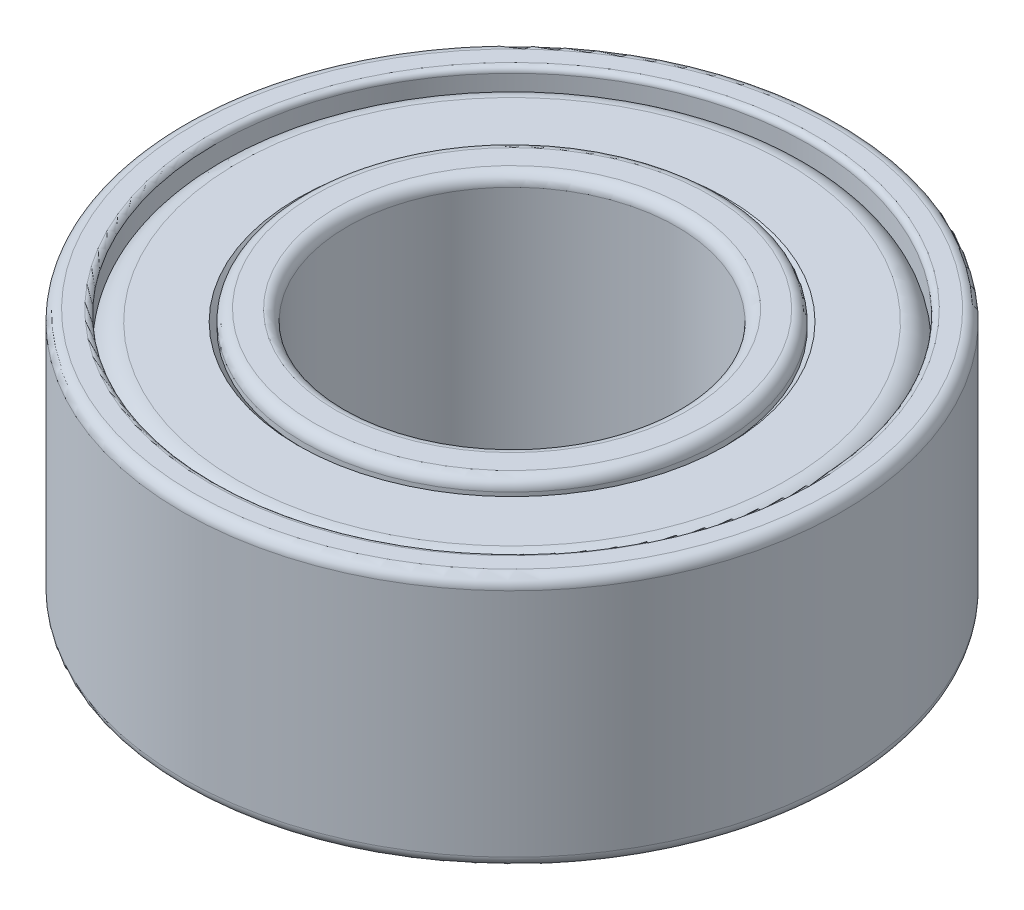
from build123d import *

# Parameters (mm, degrees)
SKETCH2_R           = 1.9
SKETCH2_R_2         = 1.5
BOSS_EXTRUDE1_DEPTH = 1.15
SKETCH4_R           = 3
SKETCH4_R_2         = 2.7
BOSS_EXTRUDE2_DEPTH = 1.15
FILLET1_R           = 0.1
FILLET2_R           = 0.1
FILLET3_R           = 0.05
SKETCH5_R           = 2.7
SKETCH5_R_2         = 1.9
BOSS_EXTRUDE3_DEPTH = 1.05
FILLET4_R           = 0.2
CHAMFER1_SIZE       = 0.05


with BuildPart() as part:
    # Sketch2 → Boss-Extrude1 (new, symmetric)
    with BuildSketch(Plane(origin=(0, 0, 0), x_dir=(1, 0, 0), z_dir=(0, 1, 0))):
        with Locations(Location((0, 0, 0), (0, 0, 270))):
            Circle(SKETCH2_R)
        with Locations(Location((0, 0, 0), (0, 0, 270))):
            Circle(SKETCH2_R_2, mode=Mode.SUBTRACT)
    extrude(amount=BOSS_EXTRUDE1_DEPTH, both=True)

    # Fillet1
    fillet1_edges = [part.edges().sort_by_distance(p)[0] for p in [
        (0, -1.15, -1.9),
        (0, 1.15, -1.9),
        (0, -1.15, -1.5),
        (0, 1.15, -1.5),
    ]]
    fillet(fillet1_edges, radius=FILLET1_R)


with BuildPart() as body_2:
    # Sketch4 → Boss-Extrude2 (new, symmetric)
    with BuildSketch(Plane(origin=(0, 0, 0), x_dir=(1, 0, 0), z_dir=(0, 1, 0))):
        with Locations(Location((0, 0, 0), (0, 0, 270))):
            Circle(SKETCH4_R)
        with Locations(Location((0, 0, 0), (0, 0, 270))):
            Circle(SKETCH4_R_2, mode=Mode.SUBTRACT)
    extrude(amount=BOSS_EXTRUDE2_DEPTH, both=True)

    # Fillet2
    fillet2_edges = [body_2.edges().sort_by_distance(p)[0] for p in [
        (0, -1.15, -3),
        (0, 1.15, -3),
    ]]
    fillet(fillet2_edges, radius=FILLET2_R)

    # Fillet3
    fillet3_edges = [body_2.edges().sort_by_distance(p)[0] for p in [
        (0, -1.15, -2.7),
        (0, 1.15, -2.7),
    ]]
    fillet(fillet3_edges, radius=FILLET3_R)


with BuildPart() as body_3:
    # Sketch5 → Boss-Extrude3 (new, symmetric)
    with BuildSketch(Plane(origin=(0, 0, 0), x_dir=(1, 0, 0), z_dir=(0, 1, 0))):
        with Locations(Location((0, 0, 0), (0, 0, 270))):
            Circle(SKETCH5_R)
        with Locations(Location((0, 0, 0), (0, 0, 270))):
            Circle(SKETCH5_R_2, mode=Mode.SUBTRACT)
    extrude(amount=BOSS_EXTRUDE3_DEPTH, both=True)

    # Fillet4
    fillet4_edges = [body_3.edges().sort_by_distance(p)[0] for p in [
        (0, -1.05, -2.7),
        (0, 1.05, -2.7),
    ]]
    fillet(fillet4_edges, radius=FILLET4_R)

    # Chamfer1
    chamfer1_edges = [body_3.edges().sort_by_distance(p)[0] for p in [
        (0, -1.05, -1.9),
        (0, 1.05, -1.9),
    ]]
    chamfer(chamfer1_edges, length=CHAMFER1_SIZE)


solid = Compound([part.part, body_2.part, body_3.part])
